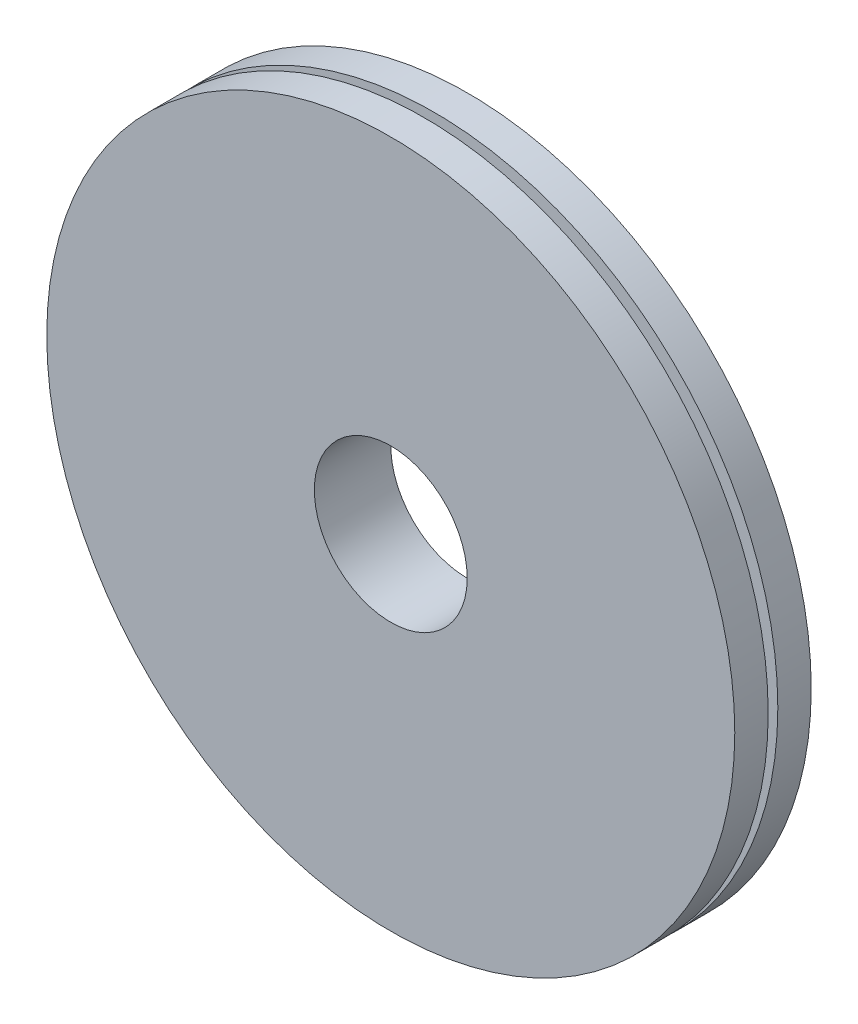
from build123d import *

# Parameters (mm, degrees)
SKETCH1_R           = 57.15
SKETCH1_R_2         = 12.7
BOSS_EXTRUDE1_DEPTH = 12.7
SKETCH3_R           = 57.15
SKETCH3_R_2         = 53.975
CUT_EXTRUDE1_DEPTH  = 0.8001


with BuildPart() as part:
    # Sketch1 → Boss-Extrude1 (new body)
    with BuildSketch(Plane.XY):
        Circle(SKETCH1_R)
        Circle(SKETCH1_R_2, mode=Mode.SUBTRACT)
    extrude(amount=BOSS_EXTRUDE1_DEPTH)

    # Sketch3 → Cut-Extrude1 (cut, symmetric)
    with BuildSketch(Plane(origin=(0, 0, 6.35), x_dir=(-1, 0, 0), z_dir=(0, 0, -1))):
        Circle(SKETCH3_R)
        Circle(SKETCH3_R_2, mode=Mode.SUBTRACT)
    extrude(amount=CUT_EXTRUDE1_DEPTH, both=True, mode=Mode.SUBTRACT)


solid = part.part
